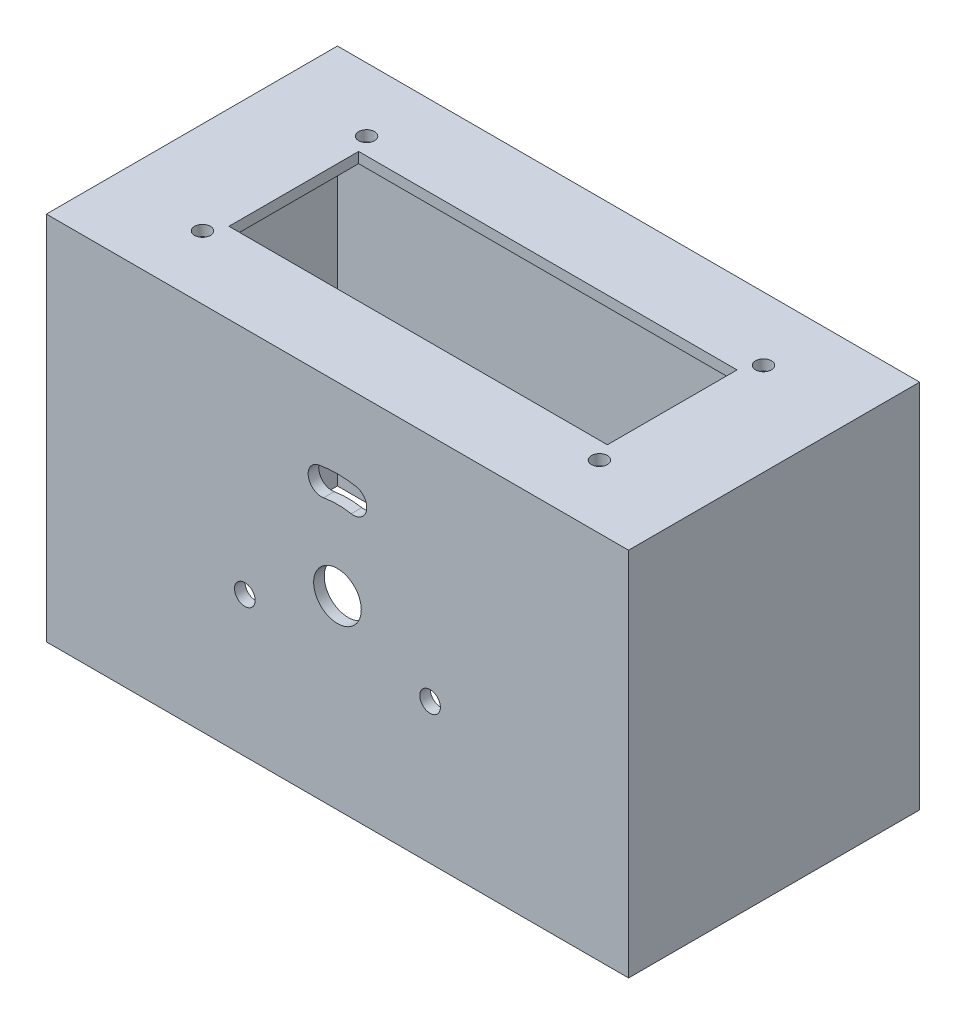
from build123d import *

# Parameters (mm, degrees)
SKETCH1_W           = 4.5
SKETCH1_H           = 2
BOSS_EXTRUDE1_DEPTH = 35
BOSS_EXTRUDE2_START = 35
SKETCH1_3_R         = 1.5
SKETCH1_3_W         = 71.5
SKETCH1_3_H         = 24.5
BOSS_EXTRUDE2_DEPTH = 2
SKETCH1_5_W         = 4.5
SKETCH1_5_H         = 2
SKETCH3_R           = 2
CUT_EXTRUDE1_DEPTH  = 2
MOVE_FACE1_BY       = 0.05
MOVE_FACE1_2_BY     = 0.05
CUT_EXTRUDE2_DEPTH  = 85.017855245


with BuildPart() as part:
    # Sketch1 → Boss-Extrude1 (new, symmetric)
    with BuildSketch(Plane(origin=(0, 0, 0), x_dir=(1, 0, 0), z_dir=(0, 1, 0))):
        Polygon((-53, 25.5), (53, 25.5), (53, -25.5), (14, -25.5), (0, -25.5), (0, -27.5), (55, -27.5), (55, 27.5), (-55, 27.5), (-55, -27.5), (-4.5, -27.5), (-4.5, -25.5), (-14, -25.5), (-53, -25.5), align=None)
        with Locations((-2.25, -26.5)):
            Rectangle(SKETCH1_W, SKETCH1_H)
    extrude(amount=BOSS_EXTRUDE1_DEPTH, both=True)

    # Sketch1<3> → Boss-Extrude2 (add)
    with BuildSketch(Plane(origin=(0, 0, 0), x_dir=(1, 0, 0), z_dir=(0, 1, 0)).offset(BOSS_EXTRUDE2_START)):
        Polygon((53, -25.5), (53, 25.5), (-53, 25.5), (-53, -25.5), (-14, -25.5), (-4.5, -25.5), (0, -25.5), (14, -25.5), align=None)
        with Locations(Location((-37.5, -15.5, 0), (0, 0, 270))):
            Circle(SKETCH1_3_R, mode=Mode.SUBTRACT)
        with Locations(Location((37.5, -15.5, 0), (0, 0, 270))):
            Circle(SKETCH1_3_R, mode=Mode.SUBTRACT)
        Rectangle(SKETCH1_3_W, SKETCH1_3_H, mode=Mode.SUBTRACT)
        with Locations(Location((-37.5, 15.5, 0), (0, 0, 270))):
            Circle(SKETCH1_3_R, mode=Mode.SUBTRACT)
        with Locations(Location((37.5, 15.5, 0), (0, 0, 270))):
            Circle(SKETCH1_3_R, mode=Mode.SUBTRACT)
    extrude(amount=-BOSS_EXTRUDE2_DEPTH)

    # Sketch1<5> → Cut-Revolve1 (revolve, cut)
    with BuildSketch(Plane(origin=(0, 0, 0), x_dir=(1, 0, 0), z_dir=(0, 1, 0)), mode=Mode.PRIVATE) as cut_revolve1_sk:
        with Locations((-2.25, -26.5)):
            Rectangle(SKETCH1_5_W, SKETCH1_5_H)
    revolve(cut_revolve1_sk.sketch.rotate(Axis((0, 0, 6), (0, 0, -1)), 180), axis=Axis((0, 0, 6), (0, 0, -1)), mode=Mode.SUBTRACT)

    # Sketch3 → Cut-Extrude1 (cut)
    with BuildSketch(Plane.XY.offset(27.5)):
        with Locations((-17.5, -8.5)):
            Circle(SKETCH3_R)
        with Locations((17.5, -8.5)):
            Circle(SKETCH3_R)
    extrude(amount=-CUT_EXTRUDE1_DEPTH, mode=Mode.SUBTRACT)

    # Move Face1: a curved face moved outward by 0.05
    add(Solid.thicken(part.faces().sort_by_distance((15.5, -8.5, 26.5))[0], MOVE_FACE1_BY))

    # Move Face1 2: a curved face moved outward by 0.05
    add(Solid.thicken(part.faces().sort_by_distance((-19.5, -8.5, 26.5))[0], MOVE_FACE1_2_BY))

    # Sketch5 → Cut-Extrude2 (cut, through all)
    with BuildSketch(Plane(origin=(0, 0, 25.5), x_dir=(-1, 0, 0), z_dir=(0, 0, -1))):
        with BuildLine():
            Line((3.472963553, 19.69615506), (2.604722665, 14.772116295))
            ThreePointArc((2.604722665, 14.772116295), (5.500862492, 16.800015234), (3.472963553, 19.69615506))
        make_face()
        with BuildLine():
            ThreePointArc((-2.604722665, 14.772116295), (0, 15), (2.604722665, 14.772116295))
            Line((2.604722665, 14.772116295), (3.472963553, 19.69615506))
            ThreePointArc((3.472963553, 19.69615506), (0, 20), (-3.472963553, 19.69615506))
            Line((-3.472963553, 19.69615506), (-2.604722665, 14.772116295))
        make_face()
        with BuildLine():
            ThreePointArc((-3.472963553, 19.69615506), (-5.500862492, 16.800015234), (-2.604722665, 14.772116295))
            Line((-2.604722665, 14.772116295), (-3.472963553, 19.69615506))
        make_face()
    extrude(amount=-CUT_EXTRUDE2_DEPTH, mode=Mode.SUBTRACT)


solid = part.part
